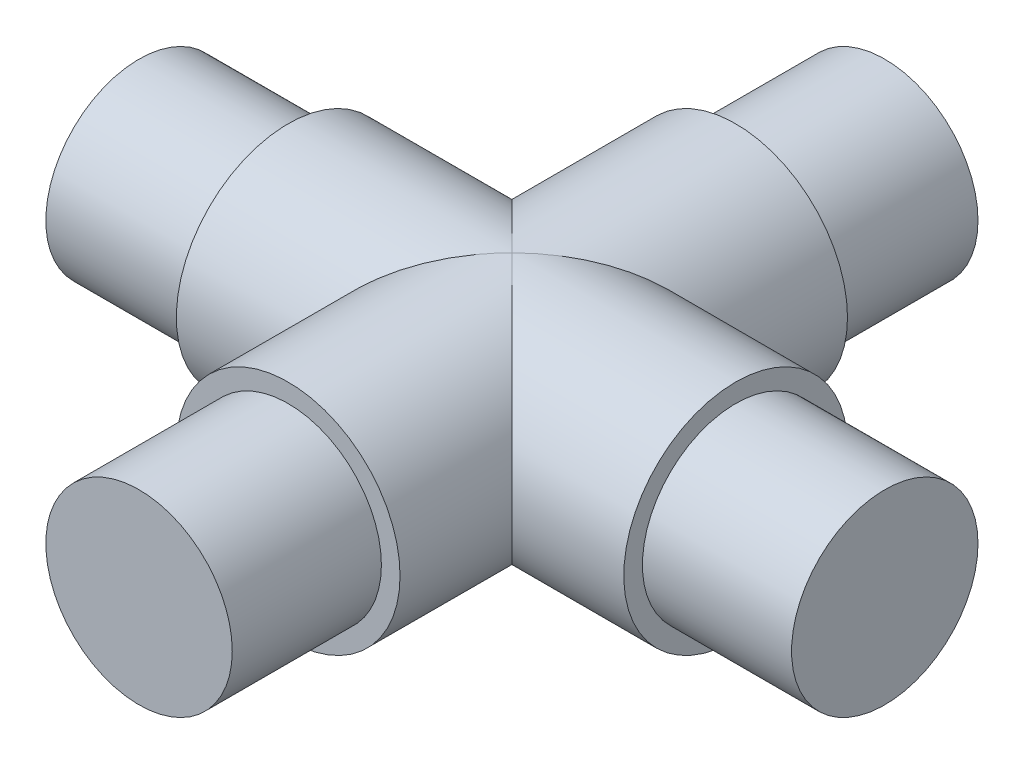
from build123d import *

# Parameters (mm, degrees)
SKETCH1_R             = 30
BOSS_EXTRUDE1_DEPTH   = 100
SKETCH2_R             = 30
SKETCH2_R_2           = 25
CUT_EXTRUDE1_DEPTH    = 40
BODY_MOVE_COPY1_ANGLE = 90


with BuildPart() as part:
    # Sketch1 → Boss-Extrude1 (new, symmetric)
    with BuildSketch(Plane.XY):
        Circle(SKETCH1_R)
    extrude(amount=BOSS_EXTRUDE1_DEPTH, both=True)

    # Sketch2 → Cut-Extrude1 (cut)
    with BuildSketch(Plane.XY.offset(100)):
        Circle(SKETCH2_R)
        Circle(SKETCH2_R_2, mode=Mode.SUBTRACT)
    cut_extrude1 = extrude(amount=-CUT_EXTRUDE1_DEPTH, mode=Mode.SUBTRACT)

    # Mirror1: Cut-Extrude1 across plane
    add(cut_extrude1.mirror(Plane.XY), mode=Mode.SUBTRACT)


with BuildPart() as body_2:
    # Body-Move/Copy1: copy of part
    add(part.part.rotate(Axis((0, 0, 0), (0, 1, 0)), BODY_MOVE_COPY1_ANGLE))


with BuildPart() as part_1:
    add(part.part)

    # Combine1: union body 2
    add(body_2.part)


solid = part_1.part
